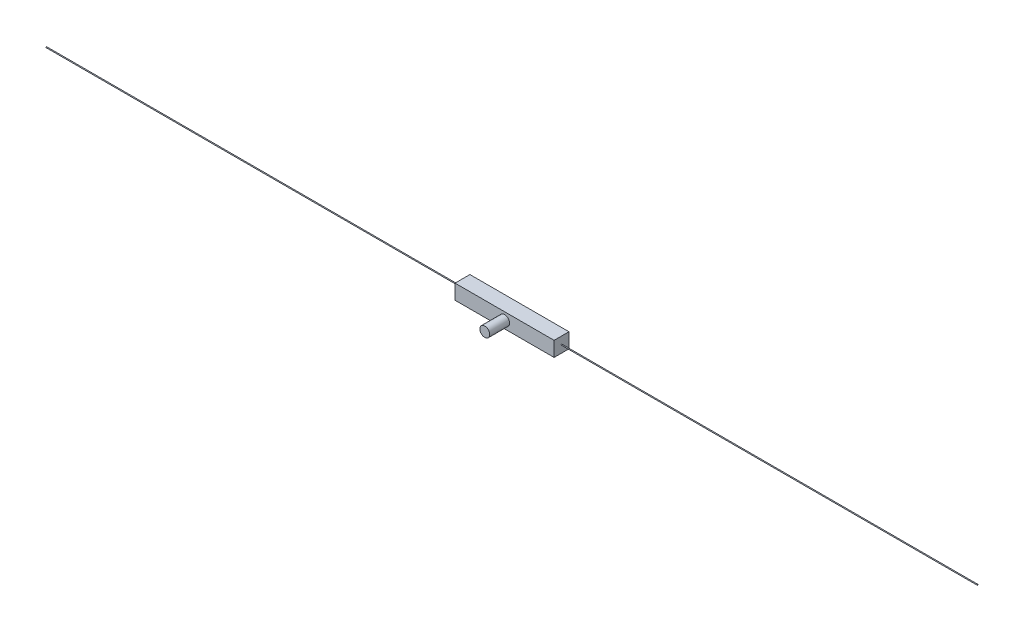
from build123d import *

# Parameters (mm, degrees)
SKETCH1_W           = 100
SKETCH1_H           = 15
SKETCH1_R           = 5
BOSS_EXTRUDE1_DEPTH = 15
SKETCH1_2_R         = 5
BOSS_EXTRUDE2_DEPTH = 35
SKETCH2_R           = 0.4064
BOSS_EXTRUDE3_DEPTH = 420
BOSS_EXTRUDE4_START = -520
SKETCH2_2_R         = 0.4064
BOSS_EXTRUDE4_DEPTH = 520


with BuildPart() as part:
    # Sketch1 → Boss-Extrude1 (new body)
    with BuildSketch(Plane.XY):
        with Locations((50, 7.5)):
            Rectangle(SKETCH1_W, SKETCH1_H)
        with Locations((50, 7.5)):
            Circle(SKETCH1_R, mode=Mode.SUBTRACT)
    extrude(amount=BOSS_EXTRUDE1_DEPTH)

    # Sketch1<2> → Boss-Extrude2 (add)
    with BuildSketch(Plane.XY):
        with Locations((50, 7.5)):
            Circle(SKETCH1_2_R)
    extrude(amount=BOSS_EXTRUDE2_DEPTH)

    # Sketch2 → Boss-Extrude3 (add)
    with BuildSketch(Plane.ZY):
        with Locations((7.5, 7.5)):
            Circle(SKETCH2_R)
    extrude(amount=BOSS_EXTRUDE3_DEPTH)

    # Sketch2<2> → Boss-Extrude4 (add)
    with BuildSketch(Plane.ZY.offset(BOSS_EXTRUDE4_START)):
        with Locations((7.5, 7.5)):
            Circle(SKETCH2_2_R)
    extrude(amount=BOSS_EXTRUDE4_DEPTH)


solid = part.part
